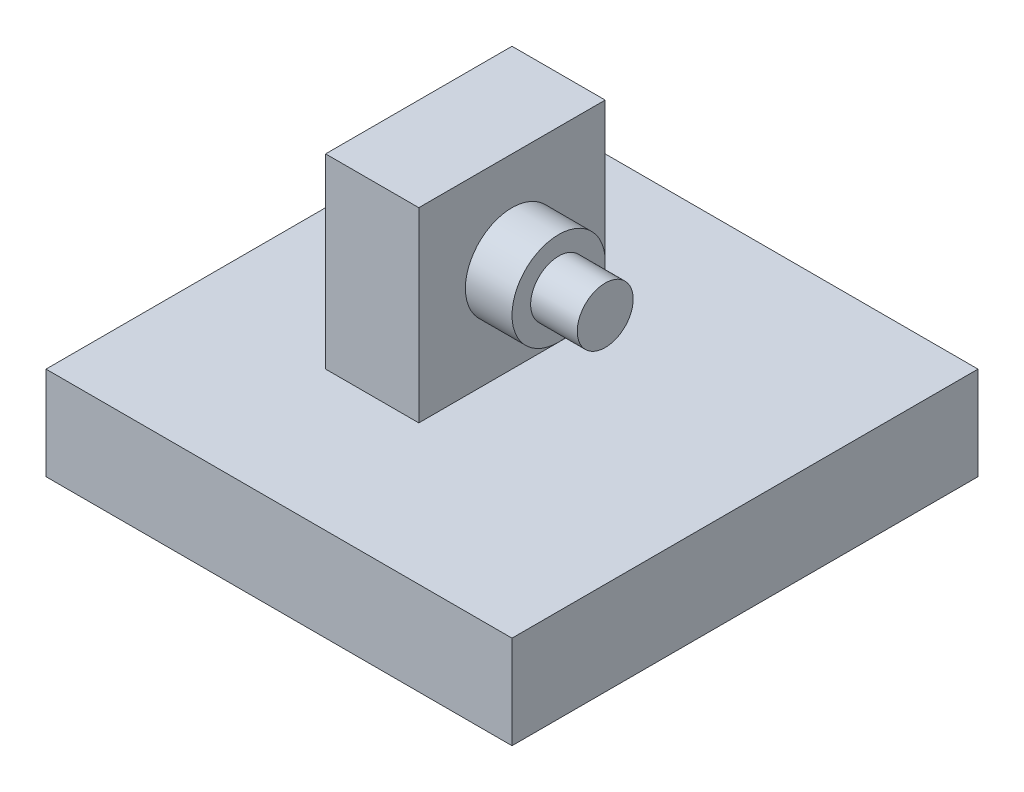
from build123d import *

# Parameters (mm, degrees)
IZIM1_W                     = 500
IZIM1_H                     = 500
Y_KSEKLIK_EKSTR_ZYON1_DEPTH = 100
IZIM2_W                     = 100
IZIM2_H                     = 200
Y_KSEKLIK_EKSTR_ZYON2_DEPTH = 200
IZIM3_R                     = 50
Y_KSEKLIK_EKSTR_ZYON3_DEPTH = 50
IZIM4_R                     = 30
Y_KSEKLIK_EKSTR_ZYON4_DEPTH = 50


with BuildPart() as part:
    # Çizim1 → Yükseklik-Ekstrüzyon1 (new body)
    with BuildSketch(Plane(origin=(0, 0, 0), x_dir=(1, 0, 0), z_dir=(0, 1, 0))):
        Rectangle(IZIM1_W, IZIM1_H)
    extrude(amount=Y_KSEKLIK_EKSTR_ZYON1_DEPTH)

    # Çizim2 → Yükseklik-Ekstrüzyon2 (add)
    with BuildSketch(Plane(origin=(0, 100, 0), x_dir=(1, 0, 0), z_dir=(0, 1, 0))):
        with Locations((-50, 0)):
            Rectangle(IZIM2_W, IZIM2_H)
    extrude(amount=Y_KSEKLIK_EKSTR_ZYON2_DEPTH)

    # Çizim3 → Yükseklik-Ekstrüzyon3 (add)
    with BuildSketch(Plane(origin=(0, 0, 0), x_dir=(0, 0, -1), z_dir=(1, 0, 0))):
        with Locations(Location((0, 200, 0), (0, 0, 180))):
            Circle(IZIM3_R)
    extrude(amount=Y_KSEKLIK_EKSTR_ZYON3_DEPTH)

    # Çizim4 → Yükseklik-Ekstrüzyon4 (add)
    with BuildSketch(Plane(origin=(50, 0, 0), x_dir=(0, 0, -1), z_dir=(1, 0, 0))):
        with Locations((0, 200)):
            Circle(IZIM4_R)
    extrude(amount=Y_KSEKLIK_EKSTR_ZYON4_DEPTH)


solid = part.part
